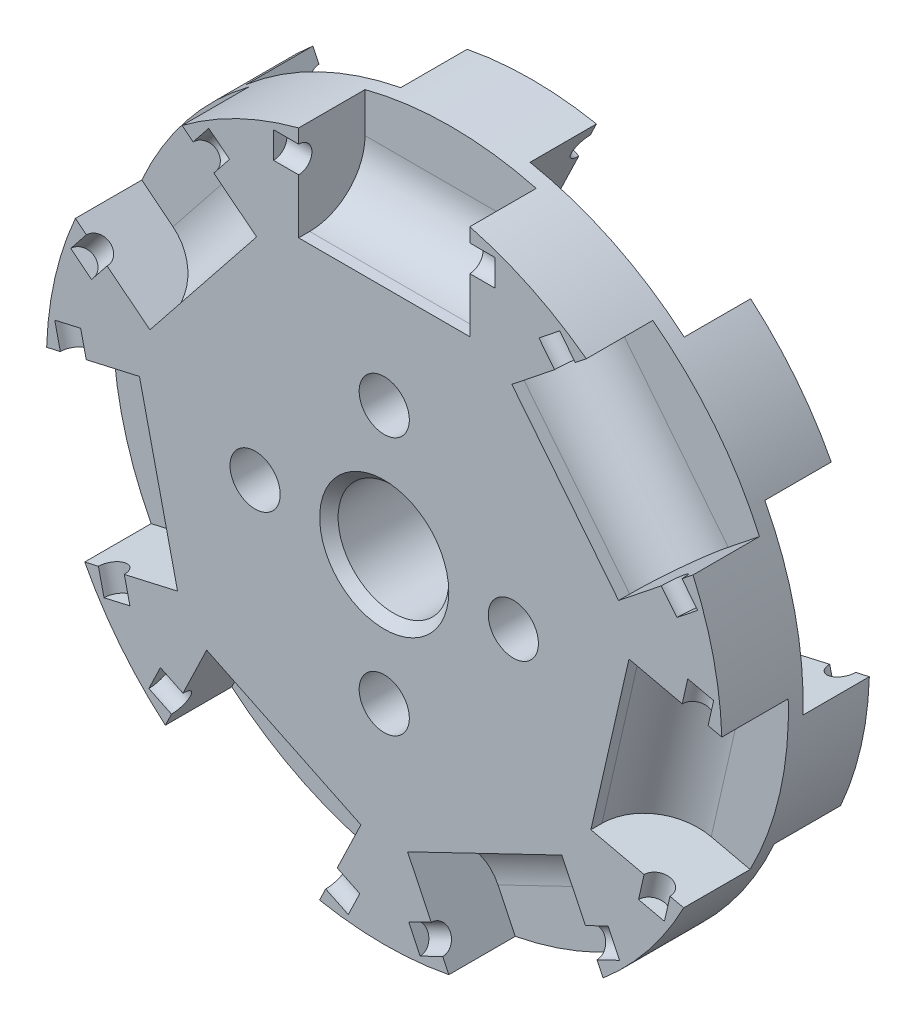
from build123d import *

# Parameters (mm, degrees)
SKETCH1_R           = 29.0703
BOSS_EXTRUDE2_DEPTH = 6.35
SKETCH2_W           = 14.732
SKETCH2_H           = 10.414
CUT_EXTRUDE2_DEPTH  = 5.715
CIRPATTERN1_COUNT   = 7
SKETCH4_R           = 1.143
CUT_EXTRUDE4_DEPTH  = 9.525
CIRPATTERN2_COUNT   = 7
SKETCH5_R           = 4.7625
CUT_EXTRUDE5_DEPTH  = 42.599124801
SKETCH6_R           = 2.159
CUT_EXTRUDE7_DEPTH  = 42.599124801
BOSS_EXTRUDE3_START = 6.35
SKETCH9_R           = 29.0703
SKETCH9_R_2         = 2.159
SKETCH9_R_3         = 4.7625
BOSS_EXTRUDE3_DEPTH = 6.35
CUT_EXTRUDE8_DEPTH  = 5.715
CIRPATTERN3_COUNT   = 7
SKETCH11_R          = 1.143
CUT_EXTRUDE9_DEPTH  = 9.525
CIRPATTERN4_COUNT   = 7
FILLET1_R           = 4.7625
CHAMFER1_SIZE       = 0.79375


with BuildPart() as part:
    # Sketch1 → Boss-Extrude2 (new body)
    with BuildSketch(Plane.XY):
        Circle(SKETCH1_R)
    extrude(amount=-BOSS_EXTRUDE2_DEPTH)

    # Sketch2 → Cut-Extrude2 (cut)
    with BuildSketch(Plane.XY):
        with Locations((0, 25.1333)):
            Rectangle(SKETCH2_W, SKETCH2_H)
    cut_extrude2 = extrude(amount=-CUT_EXTRUDE2_DEPTH, mode=Mode.SUBTRACT)

    # CirPattern1: Cut-Extrude2 ×7 about axis
    cirpattern1_axis = Axis((0, 0, 0), (0, 0, 1))
    for i in range(1, CIRPATTERN1_COUNT):
        add(cut_extrude2.rotate(cirpattern1_axis, i * 360 / CIRPATTERN1_COUNT), mode=Mode.SUBTRACT)

    # Sketch4 → Cut-Extrude4 (cut, symmetric)
    with BuildSketch(Plane(origin=(0, 0, 0), x_dir=(0, 0, -1), z_dir=(1, 0, 0))):
        with Locations((0, 25.7683)):
            Circle(SKETCH4_R)
    cut_extrude4 = extrude(amount=CUT_EXTRUDE4_DEPTH, both=True, mode=Mode.SUBTRACT)

    # CirPattern2: Cut-Extrude4 ×7 about axis
    cirpattern2_axis = Axis((0, 0, 0), (0, 0, 1))
    for i in range(1, CIRPATTERN2_COUNT):
        add(cut_extrude4.rotate(cirpattern2_axis, i * 360 / CIRPATTERN2_COUNT), mode=Mode.SUBTRACT)

    # Sketch5 → Cut-Extrude5 (cut, through all)
    with BuildSketch(Plane.XY):
        Circle(SKETCH5_R)
    extrude(amount=-CUT_EXTRUDE5_DEPTH, mode=Mode.SUBTRACT)

    # Sketch6 → Cut-Extrude7 (cut, through all)
    with BuildSketch(Plane(origin=(0, 0, -6.35), x_dir=(-1, 0, 0), z_dir=(0, 0, -1))):
        with Locations((0, 11.1125)):
            Circle(SKETCH6_R)
        with Locations((11.1125, 0)):
            Circle(SKETCH6_R)
        with Locations((0, -11.1125)):
            Circle(SKETCH6_R)
        with Locations((-11.1125, 0)):
            Circle(SKETCH6_R)
    extrude(amount=-CUT_EXTRUDE7_DEPTH, mode=Mode.SUBTRACT)

    # Sketch9 → Boss-Extrude3 (add)
    with BuildSketch(Plane(origin=(0, 0, -6.35), x_dir=(-1, 0, 0), z_dir=(0, 0, -1)).offset(BOSS_EXTRUDE3_START)):
        with Locations(Location((0, 0, 0), (0, 0, 178.179188094))):
            Circle(SKETCH9_R)
        with Locations((0, 11.1125)):
            Circle(SKETCH9_R_2, mode=Mode.SUBTRACT)
        with Locations((11.1125, 0)):
            Circle(SKETCH9_R_2, mode=Mode.SUBTRACT)
        with Locations((0, -11.1125)):
            Circle(SKETCH9_R_2, mode=Mode.SUBTRACT)
        with Locations((-11.1125, 0)):
            Circle(SKETCH9_R_2, mode=Mode.SUBTRACT)
        with Locations(Location((0, 0, 0), (0, 0, 180))):
            Circle(SKETCH9_R_3, mode=Mode.SUBTRACT)
    extrude(amount=-BOSS_EXTRUDE3_DEPTH)

    # Sketch10 → Cut-Extrude8 (cut)
    with BuildSketch(Plane(origin=(0, 0, -12.7), x_dir=(-1, 0, 0), z_dir=(0, 0, -1))):
        Polygon((-2.009055407, 21.148973594), (-15.282160644, 14.757064537), (-19.800579114, 24.139776859), (-6.527473878, 30.531685916), align=None)
    cut_extrude8 = extrude(amount=-CUT_EXTRUDE8_DEPTH, mode=Mode.SUBTRACT)

    # CirPattern3: Cut-Extrude8 ×7 about axis
    cirpattern3_axis = Axis((0, 0, 0), (0, 0, 1))
    for i in range(1, CIRPATTERN3_COUNT):
        add(cut_extrude8.rotate(cirpattern3_axis, i * 360 / CIRPATTERN3_COUNT), mode=Mode.SUBTRACT)

    # Sketch11 → Cut-Extrude9 (cut, symmetric)
    with BuildSketch(Plane(origin=(0, 0, 0), x_dir=(0, 0, -1), z_dir=(-0.900971031519736, 0.4338792462912495, 0))):
        with Locations((12.7, -25.7683)):
            Circle(SKETCH11_R)
    cut_extrude9 = extrude(amount=CUT_EXTRUDE9_DEPTH, both=True, mode=Mode.SUBTRACT)

    # CirPattern4: Cut-Extrude9 ×7 about axis
    cirpattern4_axis = Axis((0, 0, 0), (0, 0, 1))
    for i in range(1, CIRPATTERN4_COUNT):
        add(cut_extrude9.rotate(cirpattern4_axis, i * 360 / CIRPATTERN4_COUNT), mode=Mode.SUBTRACT)

    # Fillet1
    fillet1_edges = [part.edges().sort_by_distance(p)[0] for p in [
        (-15.579008669, 12.423844839, -5.715),
        (0, 19.9263, -5.715),
        (8.645608025, 17.953019065, -6.985),
        (-8.645787076, 17.952932839, -6.985),
        (-19.426728167, 4.433922012, -6.985),
        (-15.578946715, -12.423922526, -6.985),
        (9.9366e-05, -19.9263, -6.985),
        (15.579070622, -12.423767151, -6.985),
        (19.426683945, 4.434115761, -6.985),
        (8.645697551, -17.952975952, -5.715),
        (19.426706057, -4.434018886, -5.715),
        (-19.426706057, -4.434018886, -5.715),
        (-8.645697551, -17.952975952, -5.715),
        (15.579008669, 12.423844839, -5.715),
    ]]
    fillet(fillet1_edges, radius=FILLET1_R)

    # Chamfer1
    chamfer1_edges = [part.edges().sort_by_distance(p)[0] for p in [
        (-4.7625, 0, 0),
        (-4.7625, 0, -12.7),
    ]]
    chamfer(chamfer1_edges, length=CHAMFER1_SIZE)


solid = part.part
